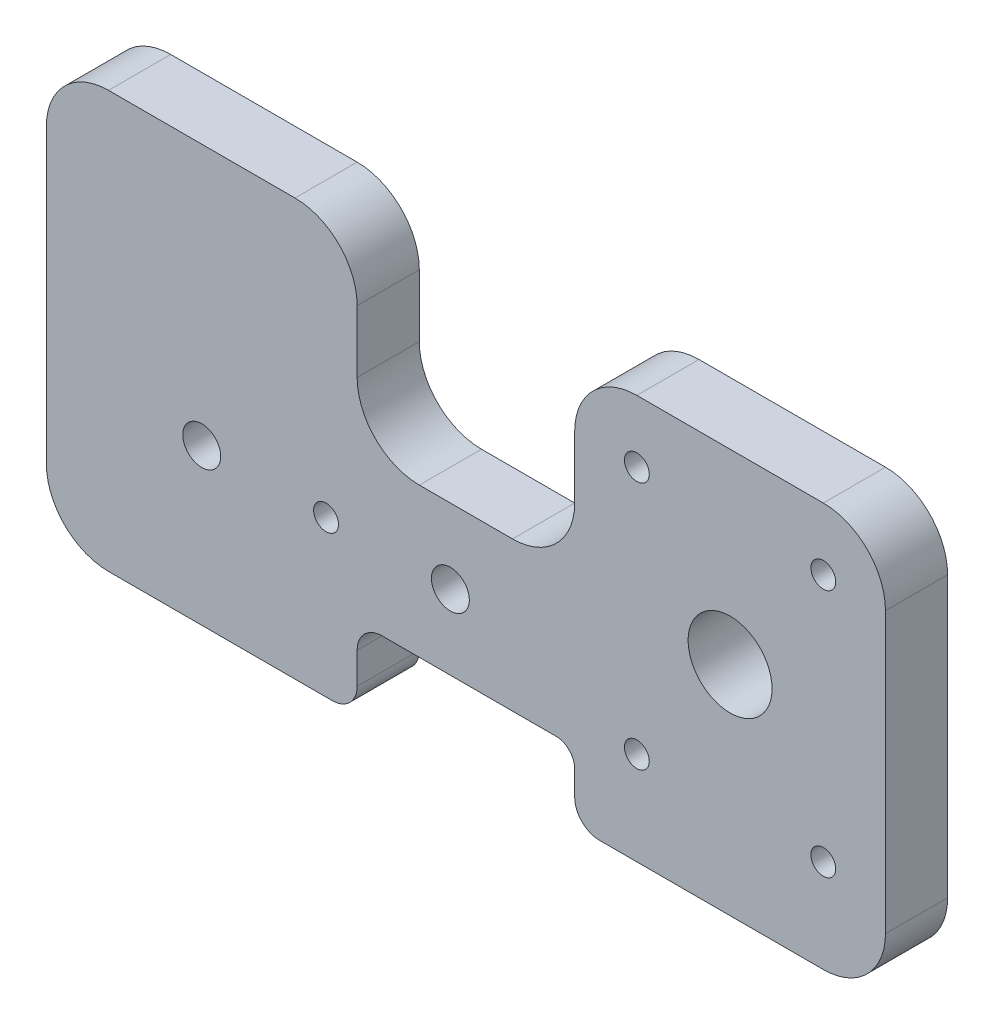
from build123d import *

# Parameters (mm, degrees)
MODEL_R             = 2
MODEL_R_2           = 3.05
MODEL_R_3           = 6.75
BOSS_EXTRUDE1_DEPTH = 10


with BuildPart() as part:
    # Model → Boss-Extrude1 (new body)
    with BuildSketch(Plane.XY):
        with BuildLine():
            Line((106.910569106, -1), (106.910569106, 3))
            ThreePointArc((106.910569106, 3), (106.031889449, 5.121320344), (103.910569106, 6))
            Line((103.910569106, 6), (75.910569106, 6))
            ThreePointArc((75.910569106, 6), (73.082141981, 4.828427125), (71.910569106, 2))
            Line((71.910569106, 2), (71.910569106, -3.03491552))
            ThreePointArc((71.910569106, -3.03491552), (70.73899623, -5.863342645), (67.910569106, -7.034915521))
            Line((67.910569106, -7.034915521), (31.910569106, -7.034915521))
            ThreePointArc((31.910569106, -7.034915521), (24.839501294, -4.105983332), (21.910569106, 2.96508448))
            Line((21.910569106, 2.96508448), (21.910569106, 50))
            ThreePointArc((21.910569106, 50), (24.839501294, 57.071067812), (31.910569106, 60))
            Line((31.910569106, 60), (61.910569106, 60))
            ThreePointArc((61.910569106, 60), (68.981636918, 57.071067812), (71.910569106, 50))
            Line((71.910569106, 50), (71.910569106, 40))
            ThreePointArc((71.910569106, 40), (74.839501294, 32.928932188), (81.910569106, 30))
            Line((81.910569106, 30), (96.910569106, 30))
            ThreePointArc((96.910569106, 30), (103.981636918, 32.928932188), (106.910569106, 40))
            Line((106.910569106, 40), (106.910569106, 50))
            ThreePointArc((106.910569106, 50), (109.839501294, 57.071067812), (116.910569106, 60))
            Line((116.910569106, 60), (146.910569106, 60))
            ThreePointArc((146.910569106, 60), (153.981636918, 57.071067812), (156.910569106, 50))
            Line((156.910569106, 50), (156.910569106, 5))
            ThreePointArc((156.910569106, 5), (153.981636918, -2.071067812), (146.910569106, -5))
            Line((146.910569106, -5), (110.910569106, -5))
            ThreePointArc((110.910569106, -5), (108.082141981, -3.828427125), (106.910569106, -1))
        make_face()
        with Locations((66.910569106, 18)):
            Circle(MODEL_R, mode=Mode.SUBTRACT)
        with Locations((46.910569106, 18)):
            Circle(MODEL_R_2, mode=Mode.SUBTRACT)
        with Locations((116.910569106, 10)):
            Circle(MODEL_R, mode=Mode.SUBTRACT)
        with Locations((146.910569106, 10)):
            Circle(MODEL_R, mode=Mode.SUBTRACT)
        with Locations((146.910569106, 50)):
            Circle(MODEL_R, mode=Mode.SUBTRACT)
        with Locations((116.910569106, 50)):
            Circle(MODEL_R, mode=Mode.SUBTRACT)
        with Locations((131.910569106, 30)):
            Circle(MODEL_R_3, mode=Mode.SUBTRACT)
        with Locations((86.910569106, 18)):
            Circle(MODEL_R_2, mode=Mode.SUBTRACT)
    extrude(amount=BOSS_EXTRUDE1_DEPTH)


solid = part.part
